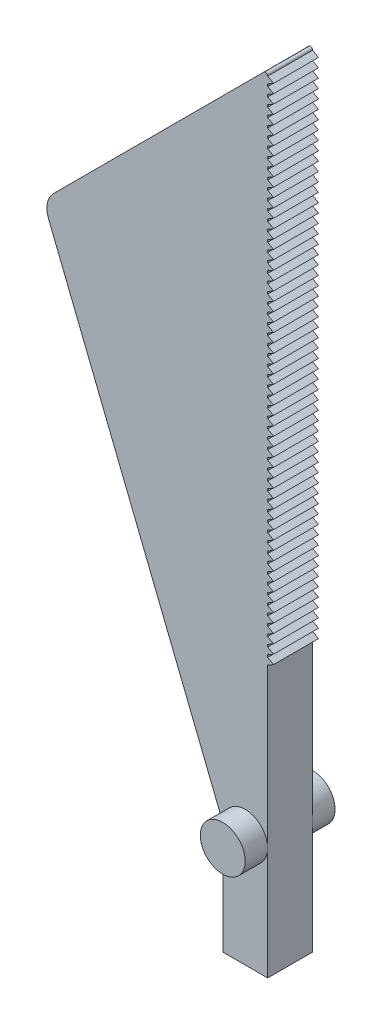
from build123d import *

# Parameters (mm, degrees)
SKETCH1_R           = 2.54
BOSS_EXTRUDE1_DEPTH = 5.08
BOSS_EXTRUDE2_DEPTH = 2.54
BOSS_EXTRUDE3_DEPTH = 2.54


with BuildPart() as part:
    # Sketch1 → Boss-Extrude1 (new, symmetric)
    with BuildSketch(Plane.XY):
        Circle(SKETCH1_R)
    extrude(amount=BOSS_EXTRUDE1_DEPTH, both=True)

    # Sketch2 → Boss-Extrude2 (add, symmetric)
    with BuildSketch(Plane.XY):
        with BuildLine():
            Line((2.54, 0), (2.54, 75.586789755))
            ThreePointArc((2.54, 75.586789755), (2.383201592, 75.821455156), (2.106394878, 75.766394878))
            Line((2.106394878, 75.766394878), (-21.675690723, 51.984309277))
            ThreePointArc((-21.675690723, 51.984309277), (-22.367766915, 50.698965368), (-22.237970294, 49.244925735))
            Line((-22.237970294, 49.244925735), (-2.54, 0))
            Line((-2.54, 0), (-2.54, -12.7))
            Line((-2.54, -12.7), (2.54, -12.7))
            Line((2.54, -12.7), (2.54, 0))
        make_face()
    extrude(amount=BOSS_EXTRUDE2_DEPTH, both=True)

    # Sketch3 → Boss-Extrude3 (add, symmetric)
    with BuildSketch(Plane.XY):
        Polygon((2.54, 75.586789755), (3.199911358, 75.205789755), (2.54, 74.824789755), align=None)
        Polygon((2.54, 74.570789755), (3.199911358, 74.189789755), (2.54, 73.808789755), align=None)
        Polygon((2.54, 73.554789755), (3.199911358, 73.173789755), (2.54, 72.792789755), align=None)
        Polygon((2.54, 72.538789755), (3.199911358, 72.157789755), (2.54, 71.776789755), align=None)
        Polygon((2.54, 71.522789755), (3.199911358, 71.141789755), (2.54, 70.760789755), align=None)
        Polygon((2.54, 70.506789755), (3.199911358, 70.125789755), (2.54, 69.744789755), align=None)
        Polygon((2.54, 69.490789755), (3.199911358, 69.109789755), (2.54, 68.728789755), align=None)
        Polygon((2.54, 68.474789755), (3.199911358, 68.093789755), (2.54, 67.712789755), align=None)
        Polygon((2.54, 67.458789755), (3.199911358, 67.077789755), (2.54, 66.696789755), align=None)
        Polygon((2.54, 66.442789755), (3.199911358, 66.061789755), (2.54, 65.680789755), align=None)
        Polygon((2.54, 65.426789755), (3.199911358, 65.045789755), (2.54, 64.664789755), align=None)
        Polygon((2.54, 64.410789755), (3.199911358, 64.029789755), (2.54, 63.648789755), align=None)
        Polygon((2.54, 63.394789755), (3.199911358, 63.013789755), (2.54, 62.632789755), align=None)
        Polygon((2.54, 62.378789755), (3.199911358, 61.997789755), (2.54, 61.616789755), align=None)
        Polygon((2.54, 61.362789755), (3.199911358, 60.981789755), (2.54, 60.600789755), align=None)
        Polygon((2.54, 60.346789755), (3.199911358, 59.965789755), (2.54, 59.584789755), align=None)
        Polygon((2.54, 59.330789755), (3.199911358, 58.949789755), (2.54, 58.568789755), align=None)
        Polygon((2.54, 58.314789755), (3.199911358, 57.933789755), (2.54, 57.552789755), align=None)
        Polygon((2.54, 57.298789755), (3.199911358, 56.917789755), (2.54, 56.536789755), align=None)
        Polygon((2.54, 56.282789755), (3.199911358, 55.901789755), (2.54, 55.520789755), align=None)
        Polygon((2.54, 55.266789755), (3.199911358, 54.885789755), (2.54, 54.504789755), align=None)
        Polygon((2.54, 54.250789755), (3.199911358, 53.869789755), (2.54, 53.488789755), align=None)
        Polygon((2.54, 53.234789755), (3.199911358, 52.853789755), (2.54, 52.472789755), align=None)
        Polygon((2.54, 52.218789755), (3.199911358, 51.837789755), (2.54, 51.456789755), align=None)
        Polygon((2.54, 51.202789755), (3.199911358, 50.821789755), (2.54, 50.440789755), align=None)
        Polygon((2.54, 50.186789755), (3.199911358, 49.805789755), (2.54, 49.424789755), align=None)
        Polygon((2.54, 49.170789755), (3.199911358, 48.789789755), (2.54, 48.408789755), align=None)
        Polygon((2.54, 48.154789755), (3.199911358, 47.773789755), (2.54, 47.392789755), align=None)
        Polygon((2.54, 47.138789755), (3.199911358, 46.757789755), (2.54, 46.376789755), align=None)
        Polygon((2.54, 46.122789755), (3.199911358, 45.741789755), (2.54, 45.360789755), align=None)
        Polygon((2.54, 45.106789755), (3.199911358, 44.725789755), (2.54, 44.344789755), align=None)
        Polygon((2.54, 44.090789755), (3.199911358, 43.709789755), (2.54, 43.328789755), align=None)
        Polygon((2.54, 43.074789755), (3.199911358, 42.693789755), (2.54, 42.312789755), align=None)
        Polygon((2.54, 42.058789755), (3.199911358, 41.677789755), (2.54, 41.296789755), align=None)
        Polygon((2.54, 41.042789755), (3.199911358, 40.661789755), (2.54, 40.280789755), align=None)
        Polygon((2.54, 40.026789755), (3.199911358, 39.645789755), (2.54, 39.264789755), align=None)
        Polygon((2.54, 39.010789755), (3.199911358, 38.629789755), (2.54, 38.248789755), align=None)
        Polygon((2.54, 37.994789755), (3.199911358, 37.613789755), (2.54, 37.232789755), align=None)
        Polygon((2.54, 36.978789755), (3.199911358, 36.597789755), (2.54, 36.216789755), align=None)
        Polygon((2.54, 35.962789755), (3.199911358, 35.581789755), (2.54, 35.200789755), align=None)
        Polygon((2.54, 34.946789755), (3.199911358, 34.565789755), (2.54, 34.184789755), align=None)
        Polygon((2.54, 33.930789755), (3.199911358, 33.549789755), (2.54, 33.168789755), align=None)
        Polygon((2.54, 32.914789755), (3.199911358, 32.533789755), (2.54, 32.152789755), align=None)
        Polygon((2.54, 31.898789755), (3.199911358, 31.517789755), (2.54, 31.136789755), align=None)
        Polygon((2.54, 30.882789755), (3.199911358, 30.501789755), (2.54, 30.120789755), align=None)
        Polygon((2.54, 29.866789755), (3.199911358, 29.485789755), (2.54, 29.104789755), align=None)
        Polygon((2.54, 28.850789755), (3.199911358, 28.469789755), (2.54, 28.088789755), align=None)
        Polygon((2.54, 27.834789755), (3.199911358, 27.453789755), (2.54, 27.072789755), align=None)
        Polygon((2.54, 26.818789755), (3.199911358, 26.437789755), (2.54, 26.056789755), align=None)
        Polygon((2.54, 25.802789755), (3.199911358, 25.421789755), (2.54, 25.040789755), align=None)
        Polygon((2.54, 24.786789755), (3.199911358, 24.405789755), (2.54, 24.024789755), align=None)
        Polygon((2.54, 23.770789755), (3.199911358, 23.389789755), (2.54, 23.008789755), align=None)
        Polygon((2.54, 22.754789755), (3.199911358, 22.373789755), (2.54, 21.992789755), align=None)
        Polygon((2.54, 21.738789755), (3.199911358, 21.357789755), (2.54, 20.976789755), align=None)
        Polygon((2.54, 20.722789755), (3.199911358, 20.341789755), (2.54, 19.960789755), align=None)
        Polygon((2.54, 19.706789755), (3.199911358, 19.325789755), (2.54, 18.944789755), align=None)
        Polygon((2.54, 18.690789755), (3.199911358, 18.309789755), (2.54, 17.928789755), align=None)
    extrude(amount=BOSS_EXTRUDE3_DEPTH, both=True)


solid = part.part
